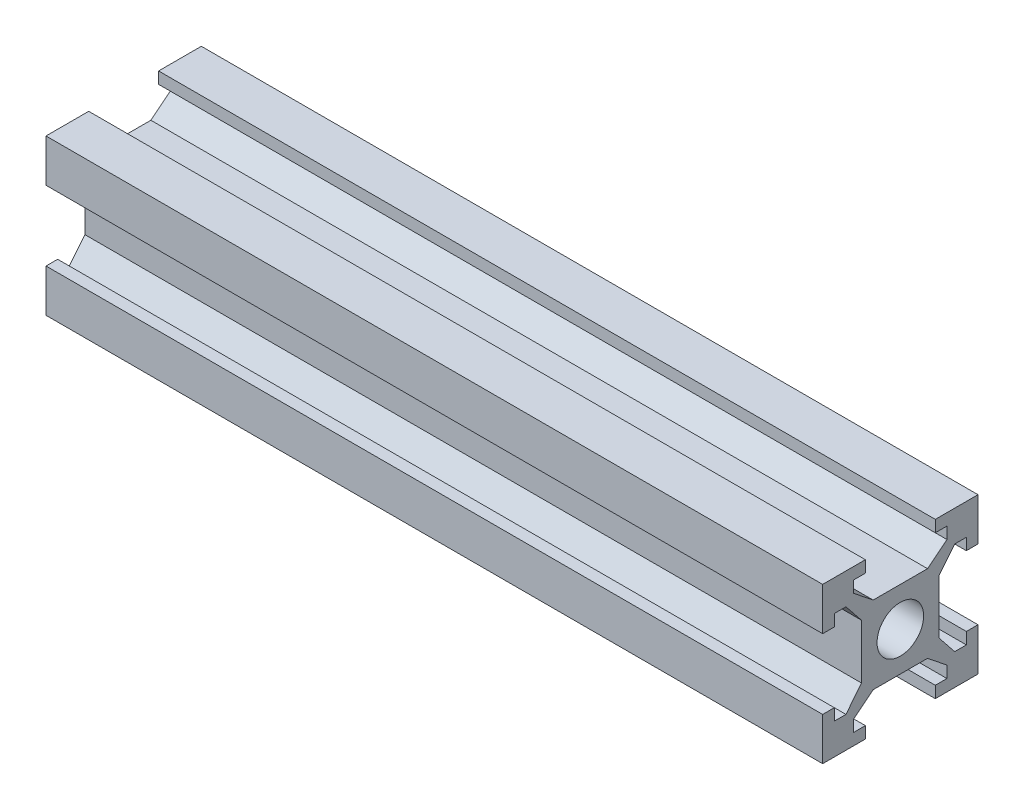
from build123d import *

# Parameters (mm, degrees)
SKETCH1_W           = 20
SKETCH1_H           = 20
BOSS_EXTRUDE1_DEPTH = 100
SKETCH2_R           = 3
CUT_EXTRUDE1_DEPTH  = 101.995049384
CUT_EXTRUDE2_DEPTH  = 101.995049384
CIRPATTERN1_COUNT   = 4


with BuildPart() as part:
    # Sketch1 → Boss-Extrude1 (new body)
    with BuildSketch(Plane(origin=(0, 0, 0), x_dir=(0, 0, -1), z_dir=(1, 0, 0))):
        Rectangle(SKETCH1_W, SKETCH1_H)
    extrude(amount=BOSS_EXTRUDE1_DEPTH)

    # Sketch2 → Cut-Extrude1 (cut, through all)
    with BuildSketch(Plane(origin=(100, 0, 0), x_dir=(0, 0, -1), z_dir=(1, 0, 0))):
        Circle(SKETCH2_R)
    extrude(amount=-CUT_EXTRUDE1_DEPTH, mode=Mode.SUBTRACT)

    # Sketch2<3> → Cut-Extrude2 (cut, through all)
    with BuildSketch(Plane(origin=(100, 0, 0), x_dir=(0, 0, -1), z_dir=(1, 0, 0))):
        Polygon((-3.5, 5), (3.5, 5), (6, 7), (6, 8.5), (4.5, 8.5), (4.5, 10), (-4.5, 10), (-4.5, 8.5), (-6, 8.5), (-6, 7), align=None)
    cut_extrude2 = extrude(amount=-CUT_EXTRUDE2_DEPTH, mode=Mode.SUBTRACT)

    # CirPattern1: Cut-Extrude2 ×4 about axis
    cirpattern1_axis = Axis((0, 0, 0), (1, 0, 0))
    for i in range(1, CIRPATTERN1_COUNT):
        add(cut_extrude2.rotate(cirpattern1_axis, i * 360 / CIRPATTERN1_COUNT), mode=Mode.SUBTRACT)


solid = part.part
